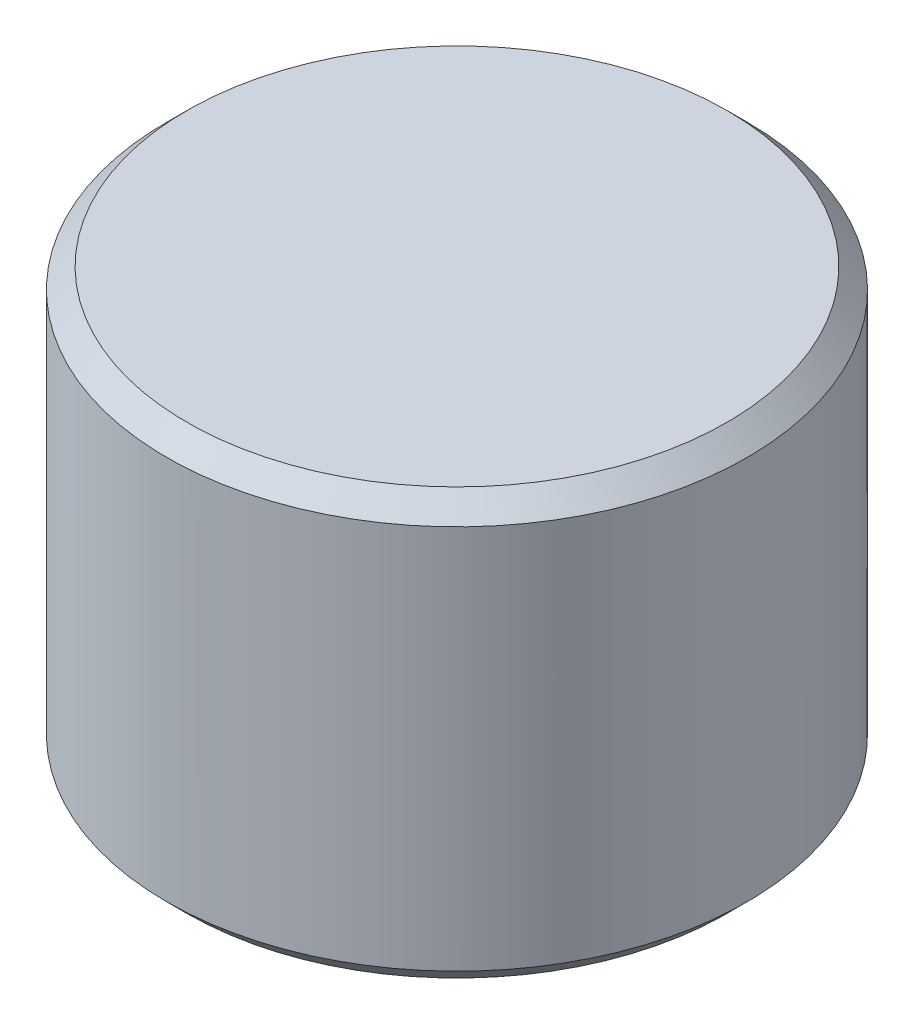
from build123d import *

# Parameters (mm, degrees)
SKETCH1_R           = 4.3
BOSS_EXTRUDE1_DEPTH = 6.3
CHAMFER1_SIZE       = 0.3


with BuildPart() as part:
    # Sketch1 → Boss-Extrude1 (new body)
    with BuildSketch(Plane(origin=(0, 0, 0), x_dir=(1, 0, 0), z_dir=(0, 1, 0))):
        with Locations(Location((0, 0, 0), (0, 0, 270))):
            Circle(SKETCH1_R)
    extrude(amount=BOSS_EXTRUDE1_DEPTH)

    # Chamfer1
    chamfer1_edges = [part.edges().sort_by_distance(p)[0] for p in [
        (0, 0, -4.3),
        (0, 6.3, -4.3),
    ]]
    chamfer(chamfer1_edges, length=CHAMFER1_SIZE)


solid = part.part
